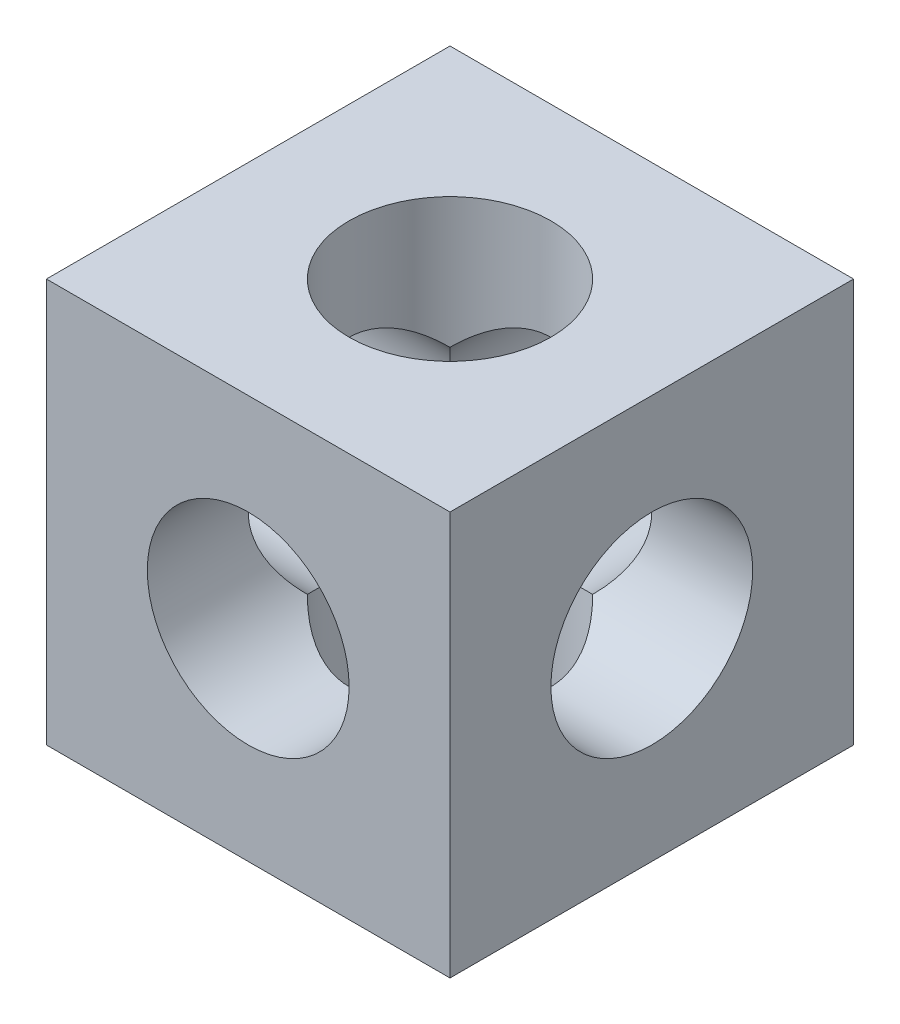
from build123d import *

# Parameters (mm, degrees)
SKETCH1_W           = 50.8
SKETCH1_H           = 50.8
BOSS_EXTRUDE1_DEPTH = 50.8
SKETCH2_R           = 12.7
CUT_EXTRUDE1_DEPTH  = 77.2
SKETCH3_R           = 12.7
CUT_EXTRUDE2_DEPTH  = 77.2
SKETCH4_R           = 12.7
CUT_EXTRUDE3_DEPTH  = 63.217039467


with BuildPart() as part:
    # Sketch1 → Boss-Extrude1 (new body)
    with BuildSketch(Plane(origin=(0, 0, 0), x_dir=(1, 0, 0), z_dir=(0, 1, 0))):
        Rectangle(SKETCH1_W, SKETCH1_H)
    extrude(amount=BOSS_EXTRUDE1_DEPTH)

    # Sketch2 → Cut-Extrude1 (cut, through all)
    with BuildSketch(Plane.XY.offset(25.4)):
        with Locations((0, 25.4)):
            Circle(SKETCH2_R)
    extrude(amount=-CUT_EXTRUDE1_DEPTH, mode=Mode.SUBTRACT)

    # Sketch3 → Cut-Extrude2 (cut, through all)
    with BuildSketch(Plane(origin=(25.4, 0, 0), x_dir=(0, 0, -1), z_dir=(1, 0, 0))):
        with Locations((0, 25.4)):
            Circle(SKETCH3_R)
    extrude(amount=-CUT_EXTRUDE2_DEPTH, mode=Mode.SUBTRACT)

    # Sketch4 → Cut-Extrude3 (cut, through all)
    with BuildSketch(Plane(origin=(0, 50.8, 0), x_dir=(1, 0, 0), z_dir=(0, 1, 0))):
        with Locations(Location((0, 0, 0), (0, 0, 270))):
            Circle(SKETCH4_R)
    extrude(amount=-CUT_EXTRUDE3_DEPTH, mode=Mode.SUBTRACT)


solid = part.part
